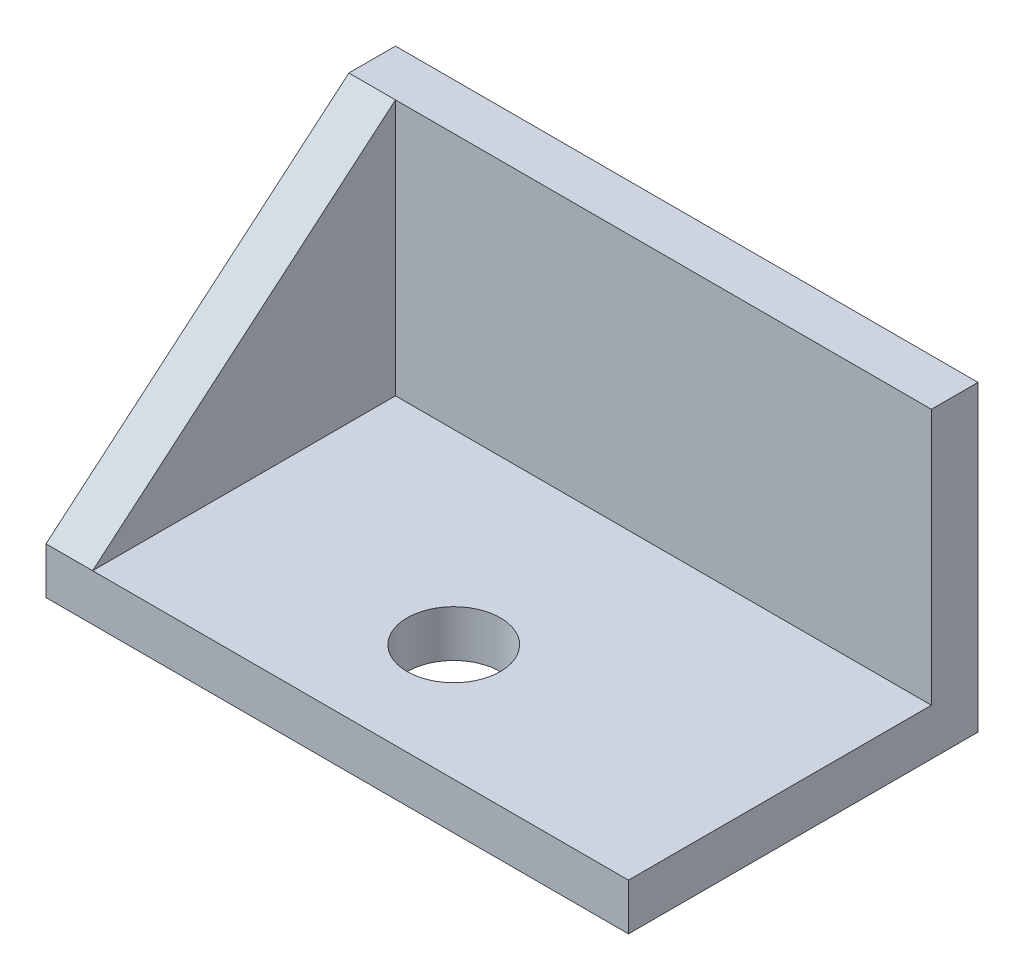
from build123d import *

# Parameters (mm, degrees)
BOSS_EXTRUDE1_DEPTH = 125
SKETCH2_W           = 65
SKETCH2_H           = 55
CUT_EXTRUDE1_DEPTH  = 115
HOLE1_D             = 20


with BuildPart() as part:
    # Sketch1 → Boss-Extrude1 (new body)
    with BuildSketch(Plane(origin=(0, 0, 0), x_dir=(0, 0, -1), z_dir=(1, 0, 0))):
        Polygon((0, 0), (-75, 0), (-75, 10), (-10, 65), (0, 65), align=None)
    extrude(amount=BOSS_EXTRUDE1_DEPTH)

    # Sketch2 → Cut-Extrude1 (cut)
    with BuildSketch(Plane(origin=(125, 0, 0), x_dir=(0, 0, -1), z_dir=(1, 0, 0))):
        with Locations((-42.5, 37.5)):
            Rectangle(SKETCH2_W, SKETCH2_H)
    extrude(amount=-CUT_EXTRUDE1_DEPTH, mode=Mode.SUBTRACT)

    # Hole1 (through all)
    with Locations(Plane(origin=(0, 10, 0), x_dir=(1, 0, 0), z_dir=(0, 1, 0))):
        with Locations((62.5, -50)):
            Hole(HOLE1_D / 2)


solid = part.part
